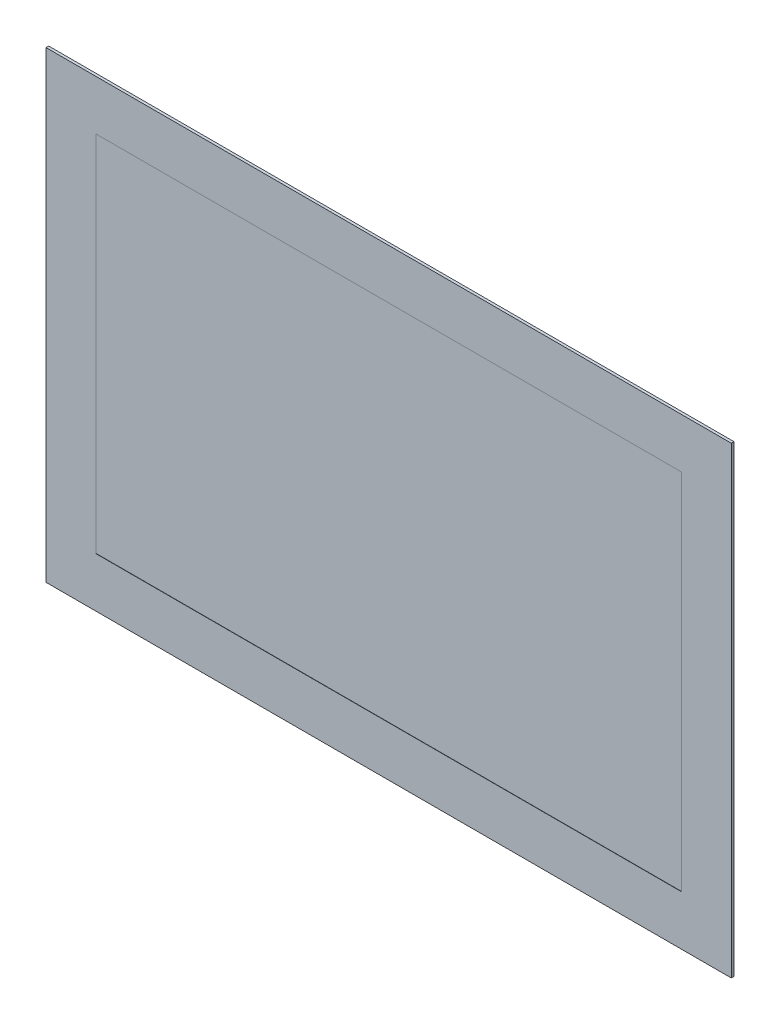
from build123d import *

# Parameters (mm, degrees)
SKETCH1_W           = 254.5
SKETCH1_H           = 172
BOSS_EXTRUDE1_DEPTH = 1
SKETCH2_W           = 230
SKETCH2_H           = 148
BOSS_EXTRUDE2_DEPTH = 9
SKETCH3_R           = 1.75
CUT_EXTRUDE1_DEPTH  = 2
SKETCH4_W           = 217.5
SKETCH4_H           = 135
CUT_EXTRUDE2_DEPTH  = 0.1


with BuildPart() as part:
    # Sketch1 → Boss-Extrude1 (new body)
    with BuildSketch(Plane.XY):
        Rectangle(SKETCH1_W, SKETCH1_H)
    extrude(amount=BOSS_EXTRUDE1_DEPTH)

    # Sketch2 → Boss-Extrude2 (add)
    with BuildSketch(Plane(origin=(0, 0, 0), x_dir=(-1, 0, 0), z_dir=(0, 0, -1))):
        with Locations((0, -2.5)):
            Rectangle(SKETCH2_W, SKETCH2_H)
    extrude(amount=BOSS_EXTRUDE2_DEPTH)

    # Sketch3 → Cut-Extrude1 (cut)
    with BuildSketch(Plane(origin=(0, 0, -9), x_dir=(-1, 0, 0), z_dir=(0, 0, -1))):
        with Locations((29, -26.5)):
            Circle(SKETCH3_R)
        with Locations((-29, -26.5)):
            Circle(SKETCH3_R)
        with Locations((-29, 22.5)):
            Circle(SKETCH3_R)
        with Locations((29, 22.5)):
            Circle(SKETCH3_R)
    extrude(amount=-CUT_EXTRUDE1_DEPTH, mode=Mode.SUBTRACT)

    # Sketch4 → Cut-Extrude2 (cut)
    with BuildSketch(Plane.XY.offset(1)):
        Rectangle(SKETCH4_W, SKETCH4_H)
    extrude(amount=-CUT_EXTRUDE2_DEPTH, mode=Mode.SUBTRACT)


solid = part.part
